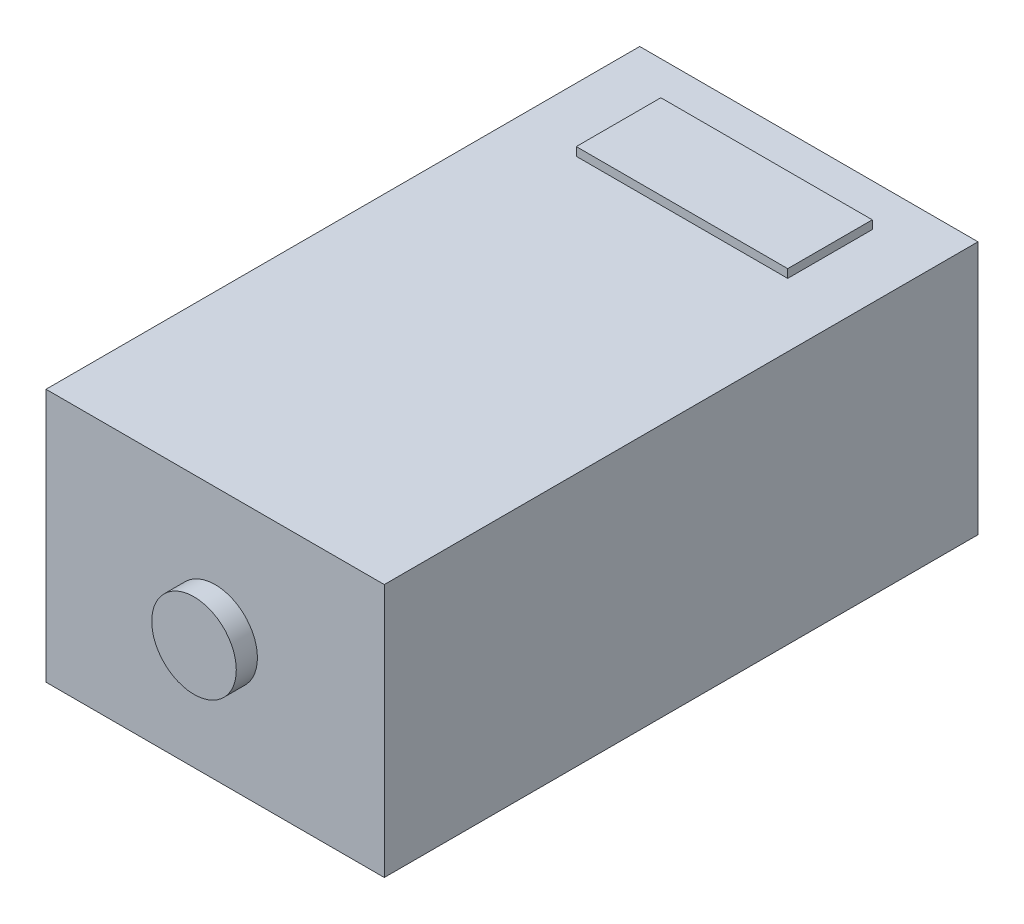
from build123d import *

# Parameters (mm, degrees)
SKETCH_1_W      = 400
SKETCH_1_H      = 300
EXTRUDE_1_DEPTH = 702
SKETCH_2_R      = 13.4
SKETCH_2_R_2    = 10.65
EXTRUDE_2_DEPTH = 25
SKETCH_3_R      = 50
EXTRUDE_3_DEPTH = 25
SKETCH_4_W      = 250
SKETCH_4_H      = 100
EXTRUDE_4_DEPTH = 10


with BuildPart() as part:
    # Эскиз1 → Бобышка-Вытянуть1 (new body)
    with BuildSketch(Plane.XY):
        with Locations((200, 150)):
            Rectangle(SKETCH_1_W, SKETCH_1_H)
    extrude(amount=EXTRUDE_1_DEPTH)

    # Эскиз2 → Бобышка-Вытянуть2 (add)
    with BuildSketch(Plane(origin=(0, 0, 0), x_dir=(-1, 0, 0), z_dir=(0, 0, -1))):
        with Locations((-332, 60)):
            Circle(SKETCH_2_R)
        with Locations((-267, 30)):
            Circle(SKETCH_2_R_2)
        with Locations((-165, 200)):
            Circle(SKETCH_2_R)
        with Locations((-133, 30)):
            Circle(SKETCH_2_R_2)
        with Locations((-68, 60)):
            Circle(SKETCH_2_R)
    extrude(amount=EXTRUDE_2_DEPTH)

    # Эскиз3 → Бобышка-Вытянуть3 (add)
    with BuildSketch(Plane.XY.offset(702)):
        with Locations((200, 150)):
            Circle(SKETCH_3_R)
    extrude(amount=EXTRUDE_3_DEPTH)

    # Эскиз4 → Бобышка-Вытянуть4 (add)
    with BuildSketch(Plane(origin=(0, 300, 0), x_dir=(1, 0, 0), z_dir=(0, 1, 0))):
        with Locations((200, -100)):
            Rectangle(SKETCH_4_W, SKETCH_4_H)
    extrude(amount=EXTRUDE_4_DEPTH)


solid = part.part
